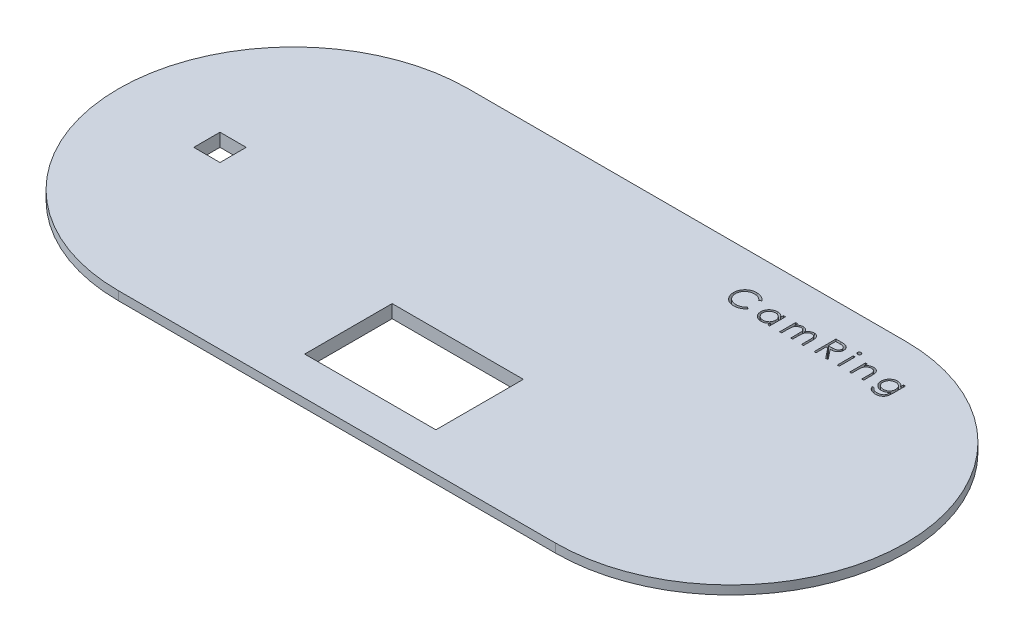
from build123d import *

# Parameters (mm, degrees)
SALIENTE_EXTRUIR1_DEPTH = 2
SALIENTE_EXTRUIR3_DEPTH = 3
CROQUIS3_W              = 30
CROQUIS3_H              = 20
CORTAR_EXTRUIR1_DEPTH   = 3
CROQUIS5_W              = 6
CROQUIS5_H              = 6
CORTAR_EXTRUIR2_DEPTH   = 3
CROQUIS6_W              = 0.448717948
CROQUIS6_H              = 3.653846154
CORTAR_EXTRUIR3_DEPTH   = 3


with BuildPart() as part:
    # Croquis1 → Saliente-Extruir1 (new body)
    with BuildSketch(Plane(origin=(0, 0, 0), x_dir=(1, 0, 0), z_dir=(0, 1, 0))):
        with BuildLine():
            Line((-48.84341637, 40), (51.15658363, 40))
            ThreePointArc((51.15658363, 40), (91.15658363, 0), (51.15658363, -40))
            Line((51.15658363, -40), (-48.84341637, -40))
            ThreePointArc((-48.84341637, -40), (-88.84341637, 0), (-48.84341637, 40))
        make_face()
    extrude(amount=SALIENTE_EXTRUIR1_DEPTH)

    # Croquis2 → Saliente-Extruir3 (add)
    with BuildSketch(Plane(origin=(0, 2, 0), x_dir=(1, 0, 0), z_dir=(0, 1, 0))):
        with BuildLine():
            Line((-49.84341637, 38), (50.15658363, 38))
            ThreePointArc((50.15658363, 38), (88.15658363, 0), (50.15658363, -38))
            Line((50.15658363, -38), (-49.84341637, -38))
            ThreePointArc((-49.84341637, -38), (-87.84341637, 0), (-49.84341637, 38))
        make_face()
    extrude(amount=-SALIENTE_EXTRUIR3_DEPTH)

    # Croquis3 → Cortar-Extruir1 (cut)
    with BuildSketch(Plane(origin=(0, 2, 0), x_dir=(1, 0, 0), z_dir=(0, 1, 0))):
        with Locations((0, -21.252534321)):
            Rectangle(CROQUIS3_W, CROQUIS3_H)
    extrude(amount=-CORTAR_EXTRUIR1_DEPTH, mode=Mode.SUBTRACT)

    # Croquis5 → Cortar-Extruir2 (cut)
    with BuildSketch(Plane(origin=(0, 2, 0), x_dir=(1, 0, 0), z_dir=(0, 1, 0))):
        with Locations((-65.624151303, 0)):
            Rectangle(CROQUIS5_W, CROQUIS5_H)
    extrude(amount=-CORTAR_EXTRUIR2_DEPTH, mode=Mode.SUBTRACT)

    # Croquis6 → Cortar-Extruir3 (cut)
    # profile 1 of 8: a face of its own
    with BuildSketch(Plane(origin=(0, 2, 0), x_dir=(1, 0, 0), z_dir=(0, 1, 0))):
        with BuildLine():
            Line((26.715211632, 31.55532032), (26.322583427, 31.25483955))
            add(Edge.make_bspline(
                [(26.322583427, 31.25483955), (26.294575015, 31.288219507), (26.238935805, 31.354529387), (26.149422658, 31.447643022), (26.056134597, 31.53487911), (25.959107281, 31.616653223), (25.856594253, 31.690105746), (25.751078827, 31.759064464), (25.640795905, 31.820875518), (25.488293427, 31.895822641), (25.288796501, 31.974031434), (25.037661016, 32.039607479), (24.775502304, 32.081352016), (24.59664859, 32.085873218), (24.505676375, 32.088172884)],
                knots=[0, 0, 0, 0, 0.757959112, 1.505699292, 2.245454638, 2.979532153, 3.711538275, 4.438200793, 5.171680507, 5.909471876, 7.393775596, 8.890124382, 10.418191784, 12, 12, 12, 12], degree=3))
            add(Edge.make_bspline(
                [(24.505676375, 32.088172884), (24.455557376, 32.087595794), (24.35578453, 32.086446972), (24.207715282, 32.071291079), (24.062410923, 32.04998935), (23.919965971, 32.018381745), (23.780561745, 31.978420861), (23.643286885, 31.93067027), (23.510128885, 31.871591927), (23.379245688, 31.806294413), (23.253846815, 31.73254092), (23.135196747, 31.652093275), (23.023728221, 31.565851708), (22.919353061, 31.473492985), (22.821964563, 31.375433041), (22.732268405, 31.270626839), (22.650574962, 31.159409448), (22.575264926, 31.043247438), (22.507818164, 30.922479164), (22.451346908, 30.796657635), (22.40133959, 30.667937487), (22.361769243, 30.534864401), (22.330448505, 30.398374735), (22.308837558, 30.258102181), (22.293854027, 30.114339781), (22.292710917, 30.016897906), (22.292134709, 29.967780255)],
                knots=[0, 0, 0, 0, 1.054917814, 2.100044995, 3.131103042, 4.146048494, 5.169673617, 6.183595914, 7.203665975, 8.234915748, 9.262203917, 10.264457458, 11.251630812, 12.227803204, 13.197192746, 14.159520551, 15.12972552, 16.100847026, 17.073214652, 18.039054194, 19.002613845, 19.979014051, 20.95965708, 21.949030935, 22.966165397, 24, 24, 24, 24], degree=3))
            add(Edge.make_bspline(
                [(22.292134709, 29.967780255), (22.293937307, 29.89387837), (22.29747647, 29.74878182), (22.328974091, 29.536252376), (22.376838507, 29.332651414), (22.448575045, 29.139251639), (22.537030832, 28.95366827), (22.648803134, 28.779041337), (22.77825533, 28.612731959), (22.927218786, 28.458670605), (23.090655666, 28.317936712), (23.266009826, 28.19400731), (23.452844523, 28.090700335), (23.649096852, 28.004734697), (23.856277014, 27.938653657), (24.074012446, 27.892133481), (24.301829582, 27.861787509), (24.457500154, 27.85888224), (24.536726055, 27.857403653)],
                knots=[0, 0, 0, 0, 1.029171465, 2.020641659, 2.987623507, 3.938342917, 4.889210282, 5.84687017, 6.821220943, 7.821438502, 8.827599549, 9.822697543, 10.807740252, 11.797342354, 12.80366471, 13.83203677, 14.896651826, 16, 16, 16, 16], degree=3))
            add(Edge.make_bspline(
                [(24.536726055, 27.857403653), (24.62401561, 27.859816195), (24.795822338, 27.864564656), (25.047776661, 27.904792155), (25.288970612, 27.970017752), (25.519417164, 28.061300498), (25.738466659, 28.179965195), (25.946461888, 28.323819306), (26.143578417, 28.494231209), (26.26210882, 28.624349964), (26.322583427, 28.690736986)],
                knots=[0, 0, 0, 0, 1.028121516, 2.023589091, 2.998037872, 3.967518031, 4.937445131, 5.927275754, 6.942489185, 8, 8, 8, 8], degree=3))
            Line((26.322583427, 28.690736986), (26.715211632, 28.393261025))
            add(Edge.make_bspline(
                [(26.715211632, 28.393261025), (26.683614332, 28.352491808), (26.620571081, 28.271148656), (26.5184882, 28.156474785), (26.410949204, 28.048611877), (26.297155332, 27.948429561), (26.17841563, 27.853923181), (26.052598041, 27.767777708), (25.921356566, 27.688790731), (25.785135882, 27.616466553), (25.644080721, 27.552299057), (25.498360099, 27.497365103), (25.348602134, 27.450043832), (25.19479998, 27.411112494), (25.036634613, 27.380725231), (24.874676792, 27.36041141), (24.708576971, 27.34649439), (24.596517798, 27.345225938), (24.539730862, 27.34458314)],
                knots=[0, 0, 0, 0, 0.986787822, 1.968848986, 2.935600012, 3.899624008, 4.868462664, 5.837806735, 6.815139263, 7.798259679, 8.787526145, 9.778297419, 10.776456485, 11.791383307, 12.812564526, 13.85620153, 14.913611965, 16, 16, 16, 16], degree=3))
            add(Edge.make_bspline(
                [(24.539730862, 27.34458314), (24.485954195, 27.344957415), (24.379617495, 27.345697498), (24.222619279, 27.357686308), (24.06977702, 27.374043075), (23.921527555, 27.398671834), (23.777061876, 27.427735177), (23.637689613, 27.466694115), (23.502039312, 27.510335782), (23.370655968, 27.56162862), (23.243427826, 27.619508881), (23.120765238, 27.684925393), (23.00272462, 27.757328057), (22.888145448, 27.835120929), (22.778720328, 27.920802789), (22.673501006, 28.013183695), (22.571897469, 28.111952282), (22.50903649, 28.183173501), (22.477431183, 28.218982178)],
                knots=[0, 0, 0, 0, 1.114604814, 2.203992996, 3.262667896, 4.300477797, 5.318619304, 6.316056647, 7.298880507, 8.271930387, 9.238335007, 10.195173496, 11.151986948, 12.108099108, 13.064862484, 14.031167946, 15.010108607, 16, 16, 16, 16], degree=3))
            add(Edge.make_bspline(
                [(22.477431183, 28.218982178), (22.426808835, 28.281183877), (22.326175297, 28.40483632), (22.19742432, 28.605244865), (22.087213527, 28.814485163), (21.998105069, 29.03365649), (21.928444022, 29.262267043), (21.880185171, 29.500432064), (21.848825736, 29.747929124), (21.84523961, 29.916267394), (21.84341676, 30.001834743)],
                knots=[0, 0, 0, 0, 0.994628077, 1.977248131, 2.950237994, 3.925870899, 4.908910175, 5.911660606, 6.938484602, 8, 8, 8, 8], degree=3))
            add(Edge.make_bspline(
                [(21.84341676, 30.001834743), (21.845638465, 30.091771105), (21.850009531, 30.268715283), (21.887146382, 30.528392359), (21.946887519, 30.777180072), (22.031740217, 31.014613992), (22.13931929, 31.241942964), (22.272214453, 31.4574304), (22.428881799, 31.662454399), (22.60809261, 31.853904044), (22.804617375, 32.028960262), (23.015072823, 32.182969124), (23.239047033, 32.311137004), (23.474072536, 32.418274379), (23.721909223, 32.500623612), (23.982028322, 32.558271022), (24.253941058, 32.594152617), (24.439458809, 32.598688628), (24.533721247, 32.600993396)],
                knots=[0, 0, 0, 0, 1.032925535, 2.032216505, 3.007276963, 3.968222605, 4.92396291, 5.891752235, 6.871517503, 7.883894988, 8.900124299, 9.891468569, 10.874487609, 11.85992873, 12.854644235, 13.869047385, 14.917252991, 16, 16, 16, 16], degree=3))
            add(Edge.make_bspline(
                [(24.533721247, 32.600993396), (24.591170493, 32.600304628), (24.704885489, 32.598941279), (24.873103564, 32.58564679), (25.036878317, 32.563484496), (25.196322577, 32.533318682), (25.352212028, 32.495879651), (25.50335523, 32.447107796), (25.650639068, 32.391341323), (25.793134651, 32.327114943), (25.930158294, 32.255019598), (26.061667321, 32.175854422), (26.186617119, 32.089717557), (26.305886902, 31.997341592), (26.417481489, 31.896772221), (26.524569316, 31.790775656), (26.623513713, 31.676298764), (26.684589706, 31.595720287), (26.715211632, 31.55532032)],
                knots=[0, 0, 0, 0, 1.096760587, 2.17092713, 3.219439832, 4.250915756, 5.268269357, 6.278326846, 7.281116186, 8.274029601, 9.260640565, 10.235837813, 11.203064059, 12.156899882, 13.114053108, 14.069676657, 15.032185724, 16, 16, 16, 16], degree=3))
        make_face()
    # profile 2 of 8: a face of its own
    with BuildSketch(Plane(origin=(0, 2, 0), x_dir=(1, 0, 0), z_dir=(0, 1, 0))):
        with BuildLine():
            Line((32.599827016, 31.126634422), (32.599827016, 27.472788268))
            Line((32.599827016, 27.472788268), (32.151109068, 27.472788268))
            Line((32.151109068, 27.472788268), (32.151109068, 28.104799486))
            add(Edge.make_bspline(
                [(32.151109068, 28.104799486), (32.100510795, 28.047600066), (32.001767631, 27.935974679), (31.836851748, 27.790143004), (31.662040065, 27.669602545), (31.478181035, 27.572245522), (31.285440687, 27.499114013), (31.084246277, 27.447133786), (30.874515733, 27.413714021), (30.731298083, 27.410376847), (30.658721247, 27.408685704)],
                knots=[0, 0, 0, 0, 1.074387032, 2.096679803, 3.090159297, 4.057316773, 5.018401886, 5.985159533, 6.978961417, 8, 8, 8, 8], degree=3))
            add(Edge.make_bspline(
                [(30.658721247, 27.408685704), (30.594195599, 27.410437665), (30.466948163, 27.413892608), (30.279763767, 27.440695899), (30.099631982, 27.483739644), (29.926382593, 27.543598058), (29.761136671, 27.622999231), (29.60247939, 27.718058157), (29.451232687, 27.831259343), (29.309701917, 27.960670812), (29.179370488, 28.101235079), (29.064997241, 28.251157289), (28.969635699, 28.409789152), (28.889892726, 28.575122229), (28.828469377, 28.748429257), (28.785649899, 28.929110925), (28.758877833, 29.116953602), (28.755424318, 29.244867206), (28.75367317, 29.309727371)],
                knots=[0, 0, 0, 0, 1.033919861, 2.038935746, 3.024066025, 3.998881131, 4.97069526, 5.957263378, 6.95902576, 7.993208707, 9.027059324, 10.027763471, 11.009749337, 11.988697705, 12.965288445, 13.950418724, 14.960734635, 16, 16, 16, 16], degree=3))
            add(Edge.make_bspline(
                [(28.75367317, 29.309727371), (28.755463129, 29.373246947), (28.759001782, 29.498821724), (28.785363525, 29.683505578), (28.829693537, 29.861388807), (28.891904748, 30.031898726), (28.971678969, 30.195241655), (29.068719094, 30.351533119), (29.183032129, 30.501203687), (29.314821282, 30.640734011), (29.457585239, 30.769620603), (29.610311998, 30.881633525), (29.769202399, 30.978371881), (29.936720986, 31.055019704), (30.110388278, 31.11703271), (30.291750344, 31.15993695), (30.480052599, 31.185218838), (30.607896159, 31.18887993), (30.672743683, 31.190736986)],
                knots=[0, 0, 0, 0, 1.020392517, 2.01726096, 2.990465484, 3.961182959, 4.928053699, 5.906110375, 6.912531644, 7.948652711, 8.985773172, 9.998621852, 10.987621588, 11.969261332, 12.953316658, 13.946091881, 14.958173133, 16, 16, 16, 16], degree=3))
            add(Edge.make_bspline(
                [(30.672743683, 31.190736986), (30.74731491, 31.188683055), (30.893545567, 31.184655394), (31.107442723, 31.151137212), (31.309791978, 31.094510831), (31.502155338, 31.017485833), (31.683842032, 30.915130506), (31.85313201, 30.786016276), (32.011796986, 30.630957438), (32.103768831, 30.511856803), (32.151109068, 30.450552691)],
                knots=[0, 0, 0, 0, 1.038897134, 2.037228247, 3.008116434, 3.962042015, 4.918381754, 5.904844433, 6.921570401, 8, 8, 8, 8], degree=3))
            Line((32.151109068, 30.450552691), (32.151109068, 31.126634422))
            Line((32.151109068, 31.126634422), (32.599827016, 31.126634422))
        make_face()
        with BuildLine():
            add(Edge.make_bspline(
                [(30.678753298, 30.742019037), (30.613161387, 30.739685269), (30.483693387, 30.735078782), (30.293630527, 30.699116646), (30.111754221, 30.639281511), (29.938974115, 30.557450224), (29.77801952, 30.454552029), (29.634171419, 30.33009291), (29.506253274, 30.187468604), (29.398670039, 30.027322732), (29.310969329, 29.855639745), (29.249302141, 29.676176262), (29.208631788, 29.492169151), (29.204476758, 29.367365314), (29.202391119, 29.304719358)],
                knots=[0, 0, 0, 0, 1.031046209, 2.035121221, 3.029706178, 4.034933723, 5.034054252, 6.02443088, 7.017295772, 8.038157696, 9.050218397, 10.03989886, 11.016116709, 12, 12, 12, 12], degree=3))
            add(Edge.make_bspline(
                [(29.202391119, 29.304719358), (29.205055252, 29.242447776), (29.210373076, 29.118148696), (29.248588354, 28.93389073), (29.312702459, 28.754384955), (29.40019112, 28.581154965), (29.509743441, 28.420320535), (29.63672723, 28.274977503), (29.782370489, 28.149992377), (29.943695499, 28.045367272), (30.1159926, 27.960849385), (30.297183931, 27.902041329), (30.483863414, 27.864073071), (30.610795319, 27.859638104), (30.674746888, 27.857403653)],
                knots=[0, 0, 0, 0, 0.979072187, 1.954306742, 2.945804271, 3.96968567, 4.997920485, 5.998718438, 6.996577872, 8.005894225, 9.015743152, 10.005417472, 10.995077863, 12, 12, 12, 12], degree=3))
            add(Edge.make_bspline(
                [(30.674746888, 27.857403653), (30.739670463, 27.85977503), (30.868797016, 27.864491464), (31.059423741, 27.900607557), (31.244416545, 27.960277269), (31.421255443, 28.042990307), (31.585992773, 28.145500815), (31.733846884, 28.265510945), (31.858869696, 28.405086923), (31.964859138, 28.558481856), (32.047966876, 28.726641851), (32.108504104, 28.905690695), (32.144295398, 29.095634621), (32.14880644, 29.22544023), (32.151109068, 29.291698525)],
                knots=[0, 0, 0, 0, 1.01762866, 2.023962475, 3.030623092, 4.058876274, 5.077231937, 6.066672613, 7.034107872, 8.005628644, 8.981990164, 9.965428785, 10.961468474, 12, 12, 12, 12], degree=3))
            add(Edge.make_bspline(
                [(32.151109068, 29.291698525), (32.14973813, 29.34218114), (32.147039691, 29.441546902), (32.126424591, 29.587443355), (32.093631839, 29.727062964), (32.047423025, 29.86055252), (31.98672119, 29.98717397), (31.913510096, 30.107836485), (31.826502311, 30.221912501), (31.727098459, 30.327831174), (31.618291027, 30.424440406), (31.503155969, 30.510675035), (31.380329188, 30.581516139), (31.251876278, 30.640146527), (31.117574371, 30.686802456), (30.976330629, 30.717927732), (30.829646362, 30.73929962), (30.729580568, 30.741103021), (30.678753298, 30.742019037)],
                knots=[0, 0, 0, 0, 1.050140795, 2.067009409, 3.05949893, 4.030605086, 5.00011959, 5.97591094, 6.962425594, 7.979863591, 8.993523472, 9.986985069, 10.967611495, 11.937549037, 12.921786183, 13.919465291, 14.943216303, 16, 16, 16, 16], degree=3))
        make_face(mode=Mode.SUBTRACT)
    # profile 3 of 8: a face of its own
    with BuildSketch(Plane(origin=(0, 2, 0), x_dir=(1, 0, 0), z_dir=(0, 1, 0))):
        with BuildLine():
            Line((34.894698811, 31.126634422), (35.34341676, 31.126634422))
            Line((35.34341676, 31.126634422), (35.34341676, 30.491618396))
            add(Edge.make_bspline(
                [(35.34341676, 30.491618396), (35.383822403, 30.547172113), (35.461243488, 30.65361836), (35.58819442, 30.793890195), (35.715017438, 30.912930416), (35.80635084, 30.975420233), (35.850227657, 31.005440512)],
                knots=[0, 0, 0, 0, 1.134379233, 2.173579362, 3.122582517, 4, 4, 4, 4], degree=3))
            add(Edge.make_bspline(
                [(35.850227657, 31.005440512), (35.910034318, 31.034019605), (36.028602746, 31.090678481), (36.216344496, 31.148154994), (36.408451166, 31.183476567), (36.538177186, 31.188307101), (36.603432786, 31.190736986)],
                knots=[0, 0, 0, 0, 1.014936303, 2.012140481, 3.000054389, 4, 4, 4, 4], degree=3))
            add(Edge.make_bspline(
                [(36.603432786, 31.190736986), (36.647565638, 31.189243714), (36.734902179, 31.186288608), (36.864308022, 31.167059986), (36.989820325, 31.133822596), (37.11069751, 31.087526419), (37.224584194, 31.031459723), (37.328997334, 30.965674426), (37.422746203, 30.891821461), (37.505783419, 30.806565843), (37.580453455, 30.707513559), (37.649137522, 30.591993204), (37.712602111, 30.457410831), (37.747775409, 30.359744344), (37.766293362, 30.308325127)],
                knots=[0, 0, 0, 0, 1.009824226, 1.998387844, 2.986035974, 3.974953746, 4.955485308, 5.885931332, 6.793869504, 7.679848016, 8.601185859, 9.625726857, 10.749998409, 12, 12, 12, 12], degree=3))
            add(Edge.make_bspline(
                [(37.766293362, 30.308325127), (37.785880864, 30.343645726), (37.824426317, 30.413151705), (37.889148656, 30.511520651), (37.956959794, 30.603530353), (38.028437641, 30.689253817), (38.103329908, 30.768267717), (38.181989051, 30.840833291), (38.263967311, 30.907262168), (38.377956225, 30.984866681), (38.52625995, 31.067296941), (38.713242971, 31.138766146), (38.907743216, 31.182932044), (39.039768499, 31.188118148), (39.106437593, 31.190736986)],
                knots=[0, 0, 0, 0, 0.86119277, 1.694706429, 2.50939023, 3.298075842, 4.073795165, 4.829715201, 5.57930267, 6.321991688, 7.768977793, 9.186738141, 10.579381044, 12, 12, 12, 12], degree=3))
            add(Edge.make_bspline(
                [(39.106437593, 31.190736986), (39.167696826, 31.188426671), (39.287587092, 31.183905159), (39.462126043, 31.148400197), (39.624900051, 31.08743213), (39.775581588, 31.00424122), (39.911524178, 30.89969953), (40.029690334, 30.775315476), (40.129362282, 30.631968872), (40.194474624, 30.497123174), (40.238639288, 30.378072698), (40.265869622, 30.276635139), (40.28992633, 30.164990064), (40.309899537, 30.043003976), (40.324497469, 29.910245964), (40.335312777, 29.766933284), (40.342632882, 29.612954553), (40.343150128, 29.506718124), (40.34341676, 29.451954935)],
                knots=[0, 0, 0, 0, 1.209669288, 2.367440248, 3.500751976, 4.631527125, 5.755587489, 6.87532382, 8.007944318, 9.190864318, 9.82315674, 10.514484317, 11.263564316, 12.079023757, 12.955305781, 13.901327259, 14.918167583, 16, 16, 16, 16], degree=3))
            Line((40.34341676, 29.451954935), (40.34341676, 27.472788268))
            Line((40.34341676, 27.472788268), (39.894698811, 27.472788268))
            Line((39.894698811, 27.472788268), (39.894698811, 29.45395814))
            add(Edge.make_bspline(
                [(39.894698811, 29.45395814), (39.89458755, 29.500701817), (39.894373722, 29.590536055), (39.890525677, 29.719468129), (39.883275229, 29.836994353), (39.874797173, 29.942954479), (39.863020303, 30.037595606), (39.847811829, 30.120727632), (39.831700857, 30.193004505), (39.804935156, 30.273127431), (39.762152454, 30.361513446), (39.696984625, 30.45683284), (39.614884473, 30.539805411), (39.520084249, 30.611831578), (39.4121579, 30.670393923), (39.293208295, 30.712216794), (39.163973936, 30.73810662), (39.07451281, 30.740686642), (39.028312593, 30.742019037)],
                knots=[0, 0, 0, 0, 1.253487763, 2.409012846, 3.458416907, 4.410876679, 5.259312806, 6.014470957, 6.676830364, 7.243083969, 8.276244668, 9.299465089, 10.325150304, 11.392391894, 12.482080715, 13.603491619, 14.762376348, 16, 16, 16, 16], degree=3))
            add(Edge.make_bspline(
                [(39.028312593, 30.742019037), (38.97164123, 30.739995955), (38.859637071, 30.735997576), (38.696143519, 30.695177758), (38.539042067, 30.633634543), (38.393020449, 30.544445318), (38.258695033, 30.437576227), (38.143124208, 30.310505376), (38.047649657, 30.166748337), (37.98300112, 30.03368162), (37.942159261, 29.914153843), (37.915192239, 29.809729026), (37.894215965, 29.691041072), (37.87454378, 29.558887513), (37.861704169, 29.412358684), (37.850035066, 29.252132397), (37.84457669, 29.077726741), (37.843813178, 28.956831471), (37.84341676, 28.894062307)],
                knots=[0, 0, 0, 0, 1.090531906, 2.155305635, 3.229839962, 4.33261226, 5.44038871, 6.529323825, 7.629011124, 8.757537029, 9.370236727, 10.061839251, 10.834451254, 11.692844982, 12.636905849, 13.66920014, 14.789842145, 16, 16, 16, 16], degree=3))
            Line((37.84341676, 28.894062307), (37.84341676, 27.472788268))
            Line((37.84341676, 27.472788268), (37.394698811, 27.472788268))
            Line((37.394698811, 27.472788268), (37.394698811, 29.330761025))
            add(Edge.make_bspline(
                [(37.394698811, 29.330761025), (37.394585338, 29.383180051), (37.394367028, 29.48402899), (37.390543718, 29.628648526), (37.383277115, 29.760192927), (37.374876332, 29.878509303), (37.362790362, 29.98338263), (37.349062131, 30.075375142), (37.33284983, 30.154256215), (37.306007138, 30.240775336), (37.264986469, 30.33609094), (37.199003237, 30.43772097), (37.116706694, 30.526675395), (37.020176871, 30.602616465), (36.911597325, 30.665390009), (36.791621039, 30.710618226), (36.661328306, 30.73693864), (36.571503012, 30.740293635), (36.525307786, 30.742019037)],
                knots=[0, 0, 0, 0, 1.320475261, 2.540461679, 3.643808994, 4.639130445, 5.527981419, 6.302341397, 6.981980563, 7.553956391, 8.582137848, 9.585246428, 10.591171744, 11.620968678, 12.668337649, 13.738356861, 14.836885341, 16, 16, 16, 16], degree=3))
            add(Edge.make_bspline(
                [(36.525307786, 30.742019037), (36.470998912, 30.739832666), (36.362763256, 30.735475305), (36.203760442, 30.696254914), (36.050209465, 30.634820522), (35.904559896, 30.549592209), (35.770739684, 30.444022096), (35.653585016, 30.31985796), (35.555095694, 30.178645055), (35.48976453, 30.04698146), (35.447623853, 29.93044821), (35.419630517, 29.831375427), (35.395573909, 29.721375073), (35.377696735, 29.600107771), (35.360438999, 29.468363351), (35.352109986, 29.325485508), (35.344007754, 29.171596812), (35.34361859, 29.065350318), (35.34341676, 29.010248204)],
                knots=[0, 0, 0, 0, 1.098833095, 2.189935336, 3.297829714, 4.440610912, 5.596351641, 6.740013378, 7.886572111, 9.072425424, 9.705826452, 10.395263256, 11.156850408, 11.985370555, 12.878090359, 13.847760091, 14.883794034, 16, 16, 16, 16], degree=3))
            Line((35.34341676, 29.010248204), (35.34341676, 27.472788268))
            Line((35.34341676, 27.472788268), (34.894698811, 27.472788268))
            Line((34.894698811, 27.472788268), (34.894698811, 31.126634422))
        make_face()
    # profile 4 of 8: a face of its own
    with BuildSketch(Plane(origin=(0, 2, 0), x_dir=(1, 0, 0), z_dir=(0, 1, 0))):
        with BuildLine():
            Line((42.766493683, 32.472788268), (43.767094645, 32.472788268))
            add(Edge.make_bspline(
                [(43.767094645, 32.472788268), (43.833867685, 32.472566003), (43.96207932, 32.472139228), (44.145755421, 32.469759566), (44.312651273, 32.462939058), (44.462679615, 32.457069653), (44.595837694, 32.44636688), (44.712533824, 32.436137384), (44.812230534, 32.42274644), (44.87258175, 32.410310122), (44.899907145, 32.404679294)],
                knots=[0, 0, 0, 0, 1.410062039, 2.707475311, 3.878576406, 4.937260626, 5.877586885, 6.699081471, 7.410979367, 8, 8, 8, 8], degree=3))
            add(Edge.make_bspline(
                [(44.899907145, 32.404679294), (44.936488036, 32.395641058), (45.00886945, 32.377757395), (45.11308383, 32.339957966), (45.212390007, 32.296215645), (45.30637547, 32.244838901), (45.394569458, 32.185446359), (45.47788133, 32.119063327), (45.556689135, 32.046053033), (45.627805749, 31.964574688), (45.694861538, 31.87909396), (45.751416718, 31.786660021), (45.800168832, 31.690000696), (45.838983857, 31.588132957), (45.870238104, 31.482044711), (45.892275589, 31.370775002), (45.905491571, 31.254830752), (45.906837079, 31.175748025), (45.907519324, 31.135648845)],
                knots=[0, 0, 0, 0, 1.027469482, 2.033020251, 3.019912614, 3.986113645, 4.951240523, 5.91722682, 6.890402269, 7.87763091, 8.8651537, 9.85103654, 10.82876324, 11.815024772, 12.821070561, 13.842952187, 14.906261191, 16, 16, 16, 16], degree=3))
            add(Edge.make_bspline(
                [(45.907519324, 31.135648845), (45.905420755, 31.069027267), (45.901325904, 30.939031313), (45.863147185, 30.750372911), (45.800609299, 30.574388176), (45.714433172, 30.411298693), (45.604691064, 30.264283485), (45.472798505, 30.135154264), (45.318681917, 30.027097246), (45.175211466, 29.952164667), (45.048476895, 29.904174798), (44.944143591, 29.870408571), (44.830333623, 29.844320049), (44.708137431, 29.820948432), (44.577046495, 29.803303155), (44.43737501, 29.790379448), (44.289023364, 29.782302236), (44.187110408, 29.781099372), (44.134682786, 29.780480576)],
                knots=[0, 0, 0, 0, 1.260483769, 2.459530307, 3.627416485, 4.787058657, 5.939039949, 7.08810263, 8.267026773, 9.491475466, 10.141966685, 10.831826277, 11.566392101, 12.351337768, 13.187381173, 14.07005841, 15.007169909, 16, 16, 16, 16], degree=3))
            Line((44.134682786, 29.780480576), (45.971621888, 27.472788268))
            Line((45.971621888, 27.472788268), (45.416734068, 27.472788268))
            Line((45.416734068, 27.472788268), (43.579794965, 29.780480576))
            Line((43.579794965, 29.780480576), (43.215211632, 29.780480576))
            Line((43.215211632, 29.780480576), (43.215211632, 27.472788268))
            Line((43.215211632, 27.472788268), (42.766493683, 27.472788268))
            Line((42.766493683, 27.472788268), (42.766493683, 32.472788268))
        make_face()
        with BuildLine():
            Line((43.215211632, 31.959967755), (43.215211632, 30.293301089))
            Line((43.215211632, 30.293301089), (44.130676375, 30.286289871))
            add(Edge.make_bspline(
                [(44.130676375, 30.286289871), (44.173419288, 30.286270961), (44.256267227, 30.286234309), (44.376125319, 30.291939704), (44.487725479, 30.298430159), (44.590640839, 30.308357795), (44.684917375, 30.321152183), (44.770507966, 30.337156446), (44.847552326, 30.35580225), (44.93740738, 30.384661716), (45.037745282, 30.430384599), (45.146790225, 30.49690674), (45.239650708, 30.58057691), (45.318104797, 30.676253276), (45.381146841, 30.781447917), (45.425592633, 30.894899873), (45.453796122, 31.013745013), (45.457122616, 31.095428024), (45.458801375, 31.136650448)],
                knots=[0, 0, 0, 0, 1.146690395, 2.22261258, 3.21895312, 4.145990853, 4.996080663, 5.770904154, 6.481378293, 7.121626537, 8.300444488, 9.431385265, 10.535395872, 11.636531494, 12.74115979, 13.810798291, 14.895190096, 16, 16, 16, 16], degree=3))
            add(Edge.make_bspline(
                [(45.458801375, 31.136650448), (45.457084059, 31.176859839), (45.453680966, 31.25654018), (45.425897011, 31.37319148), (45.378912181, 31.483287123), (45.315594698, 31.586379245), (45.238453048, 31.679958867), (45.14799903, 31.760026229), (45.046705894, 31.826096893), (44.952032753, 31.868317436), (44.86741245, 31.894202941), (44.793941507, 31.912418889), (44.71092511, 31.927053845), (44.617960169, 31.938779646), (44.515443554, 31.948858138), (44.402856909, 31.955646393), (44.280947223, 31.959666199), (44.196451607, 31.959864897), (44.152711632, 31.959967755)],
                knots=[0, 0, 0, 0, 1.101028733, 2.181837193, 3.264309656, 4.369019818, 5.486613113, 6.575447106, 7.666700264, 8.788928104, 9.402425223, 10.0903467, 10.862060571, 11.710948788, 12.657782767, 13.684531032, 14.801375019, 16, 16, 16, 16], degree=3))
            Line((44.152711632, 31.959967755), (43.215211632, 31.959967755))
        make_face(mode=Mode.SUBTRACT)
    # profile 5 of 8: a face of its own
    with BuildSketch(Plane(origin=(0, 2, 0), x_dir=(1, 0, 0), z_dir=(0, 1, 0))):
        with BuildLine():
            add(Edge.make_bspline(
                [(48.29654176, 32.665095961), (48.324386497, 32.663804314), (48.378911839, 32.661275023), (48.457759365, 32.63961577), (48.529555096, 32.602901933), (48.593237572, 32.553645246), (48.647883124, 32.49571747), (48.686141282, 32.428201801), (48.710730419, 32.355260889), (48.713699784, 32.30438219), (48.715211632, 32.278477371)],
                knots=[0, 0, 0, 0, 1.055194115, 2.066272739, 3.074728998, 4.095836921, 5.109056067, 6.073838105, 7.019297344, 8, 8, 8, 8], degree=3))
            add(Edge.make_bspline(
                [(48.715211632, 32.278477371), (48.713665689, 32.253245009), (48.710609544, 32.203363616), (48.686160275, 32.131687228), (48.647557078, 32.06510968), (48.593272612, 32.007294379), (48.529545811, 31.958064922), (48.457761831, 31.921343867), (48.378911191, 31.899686528), (48.324386277, 31.897156972), (48.29654176, 31.895865191)],
                knots=[0, 0, 0, 0, 0.96129708, 1.900370562, 2.859976407, 3.87933698, 4.906634145, 5.921202961, 6.938410037, 8, 8, 8, 8], degree=3))
            add(Edge.make_bspline(
                [(48.29654176, 31.895865191), (48.269015653, 31.897107649), (48.215439681, 31.89952593), (48.137772763, 31.921768812), (48.066589207, 31.958077488), (48.002782532, 32.006972038), (47.949596542, 32.065464749), (47.910884648, 32.131646597), (47.886491845, 32.203373961), (47.88342809, 32.253248484), (47.881878298, 32.278477371)],
                knots=[0, 0, 0, 0, 1.054934014, 2.053291228, 3.073705704, 4.106921865, 5.123545215, 6.088680038, 7.033164197, 8, 8, 8, 8], degree=3))
            add(Edge.make_bspline(
                [(47.881878298, 32.278477371), (47.883394136, 32.304378585), (47.886371338, 32.355250203), (47.910902932, 32.428243107), (47.949274086, 32.495359538), (48.002817749, 32.553967394), (48.066579835, 32.602889444), (48.137775185, 32.639190846), (48.215439041, 32.661435617), (48.269015435, 32.663853637), (48.29654176, 32.665095961)],
                knots=[0, 0, 0, 0, 0.98631895, 1.937192651, 2.907499808, 3.917963147, 4.944918757, 5.95915025, 6.951458133, 8, 8, 8, 8], degree=3))
        make_face()
    # profile 6 of 8: a face of its own
    with BuildSketch(Plane(origin=(0, 2, 0), x_dir=(1, 0, 0), z_dir=(0, 1, 0))):
        with Locations((48.298544965, 29.299711345)):
            Rectangle(CROQUIS6_W, CROQUIS6_H)
    # profile 7 of 8: a face of its own
    with BuildSketch(Plane(origin=(0, 2, 0), x_dir=(1, 0, 0), z_dir=(0, 1, 0))):
        with BuildLine():
            Line((50.881878298, 31.126634422), (51.330596247, 31.126634422))
            Line((51.330596247, 31.126634422), (51.330596247, 30.467579935))
            add(Edge.make_bspline(
                [(51.330596247, 30.467579935), (51.378507154, 30.527355253), (51.471479942, 30.643351344), (51.626314703, 30.795809308), (51.789948847, 30.921445343), (51.96138028, 31.02159362), (52.140841723, 31.097088801), (52.327239252, 31.151611559), (52.521688832, 31.184304172), (52.653923742, 31.188575929), (52.720820606, 31.190736986)],
                knots=[0, 0, 0, 0, 1.12780773, 2.188550248, 3.19190651, 4.159438251, 5.104880172, 6.052711206, 7.014878035, 8, 8, 8, 8], degree=3))
            add(Edge.make_bspline(
                [(52.720820606, 31.190736986), (52.788435798, 31.18824385), (52.920775037, 31.183364181), (53.113457982, 31.144768908), (53.293419973, 31.078847115), (53.460019339, 30.988544157), (53.610201072, 30.876249195), (53.742093717, 30.745423792), (53.85118407, 30.594943673), (53.92432316, 30.455339165), (53.972502657, 30.33149803), (54.002834568, 30.225431244), (54.028593113, 30.107262457), (54.050924181, 29.977348758), (54.066034341, 29.834779915), (54.0779519, 29.680140355), (54.086492892, 29.513480168), (54.086831759, 29.398213558), (54.087006503, 29.338773845)],
                knots=[0, 0, 0, 0, 1.235846778, 2.418850247, 3.575807741, 4.728682307, 5.871620074, 6.994088408, 8.11269785, 9.256955736, 9.865816715, 10.540099792, 11.271859618, 12.076849838, 12.949306005, 13.892391288, 14.913166135, 16, 16, 16, 16], degree=3))
            Line((54.087006503, 29.338773845), (54.087006503, 27.472788268))
            Line((54.087006503, 27.472788268), (53.638288555, 27.472788268))
            Line((53.638288555, 27.472788268), (53.638288555, 29.191538268))
            add(Edge.make_bspline(
                [(53.638288555, 29.191538268), (53.638012543, 29.241284618), (53.63748458, 29.336440919), (53.635819371, 29.472682381), (53.631805361, 29.596234636), (53.626164914, 29.706802304), (53.617909156, 29.804279213), (53.609305397, 29.888863894), (53.598784002, 29.960448955), (53.589408412, 30.003541929), (53.585203619, 30.022868396)],
                knots=[0, 0, 0, 0, 1.430800155, 2.736877192, 3.918605307, 4.986035426, 5.920637409, 6.731861385, 7.431261377, 8, 8, 8, 8], degree=3))
            add(Edge.make_bspline(
                [(53.585203619, 30.022868396), (53.570024288, 30.079598661), (53.540808773, 30.188786867), (53.468617368, 30.336893085), (53.377454253, 30.462890496), (53.266171611, 30.566000099), (53.13584436, 30.646244151), (52.986834156, 30.701921229), (52.820578955, 30.736744471), (52.703644123, 30.740211803), (52.642695606, 30.742019037)],
                knots=[0, 0, 0, 0, 1.084156227, 2.086665306, 3.027808233, 3.945421172, 4.874247719, 5.839848303, 6.874090471, 8, 8, 8, 8], degree=3))
            add(Edge.make_bspline(
                [(52.642695606, 30.742019037), (52.606598915, 30.741339031), (52.535164497, 30.739993315), (52.429235965, 30.726491461), (52.326487147, 30.704407953), (52.225886848, 30.674595614), (52.129447143, 30.633649515), (52.034069584, 30.587178986), (51.943345635, 30.529252969), (51.855340782, 30.464694938), (51.773465342, 30.393153213), (51.697282002, 30.317661056), (51.629370544, 30.237267336), (51.567843865, 30.153267411), (51.514732061, 30.064507643), (51.468370506, 29.971844348), (51.429033799, 29.875155564), (51.409487096, 29.808048333), (51.399706824, 29.774470961)],
                knots=[0, 0, 0, 0, 1.023777757, 2.026029729, 3.023749952, 4.003683103, 4.997618607, 5.993177895, 7.010360494, 8.046726602, 9.087585522, 10.09234134, 11.086953743, 12.070360549, 13.043493632, 14.017870808, 15.008233677, 16, 16, 16, 16], degree=3))
            add(Edge.make_bspline(
                [(51.399706824, 29.774470961), (51.394078755, 29.74982067), (51.381826742, 29.696158278), (51.368593628, 29.608094822), (51.356582806, 29.506223429), (51.346530008, 29.390662976), (51.340379413, 29.261008869), (51.333673132, 29.117814815), (51.331231616, 28.960509832), (51.330813967, 28.850993128), (51.330596247, 28.79390205)],
                knots=[0, 0, 0, 0, 0.615963638, 1.340920617, 2.168419149, 3.115676021, 4.16674242, 5.331190069, 6.6087489, 8, 8, 8, 8], degree=3))
            Line((51.330596247, 28.79390205), (51.330596247, 27.472788268))
            Line((51.330596247, 27.472788268), (50.881878298, 27.472788268))
            Line((50.881878298, 27.472788268), (50.881878298, 31.126634422))
        make_face()
    # profile 8 of 8: a face of its own
    with BuildSketch(Plane(origin=(0, 2, 0), x_dir=(1, 0, 0), z_dir=(0, 1, 0))):
        with BuildLine():
            Line((59.587006503, 31.126634422), (60.035724452, 31.126634422))
            Line((60.035724452, 31.126634422), (60.035724452, 28.226994999))
            add(Edge.make_bspline(
                [(60.035724452, 28.226994999), (60.035328677, 28.165227007), (60.034564736, 28.045999903), (60.029063348, 27.873602361), (60.017462381, 27.714365096), (60.004307122, 27.567561869), (59.985383241, 27.43387314), (59.962274145, 27.312899991), (59.936223175, 27.20452633), (59.91333715, 27.137776557), (59.902511311, 27.10620173)],
                knots=[0, 0, 0, 0, 1.307562039, 2.523909702, 3.650326591, 4.686913197, 5.643429486, 6.506965704, 7.293745905, 8, 8, 8, 8], degree=3))
            add(Edge.make_bspline(
                [(59.902511311, 27.10620173), (59.886526684, 27.065158985), (59.855035361, 26.984300646), (59.796055885, 26.869680188), (59.730007451, 26.761756774), (59.654569236, 26.661131843), (59.570082373, 26.56831054), (59.478537384, 26.481276255), (59.378151396, 26.401870302), (59.268981807, 26.331462734), (59.153545188, 26.268052657), (59.0319079, 26.213128989), (58.904755845, 26.165290641), (58.770894571, 26.129458076), (58.632422808, 26.098408475), (58.487712192, 26.078201781), (58.337608196, 26.064448841), (58.235543368, 26.063177079), (58.183761311, 26.062531858)],
                knots=[0, 0, 0, 0, 0.981931301, 1.934503488, 2.87077864, 3.801706999, 4.735015492, 5.667491629, 6.616593066, 7.585388521, 8.561939025, 9.551802639, 10.560317337, 11.588439944, 12.640189604, 13.723962949, 14.845264515, 16, 16, 16, 16], degree=3))
            add(Edge.make_bspline(
                [(58.183761311, 26.062531858), (58.10821169, 26.063755409), (57.960642983, 26.066145333), (57.745492993, 26.093989498), (57.541157679, 26.133352888), (57.350337027, 26.19293207), (57.174236888, 26.265842055), (57.014059923, 26.349549131), (56.871244055, 26.445533858), (56.742495951, 26.554820431), (56.626293679, 26.684768547), (56.51696898, 26.837909753), (56.411739063, 27.016576738), (56.35006958, 27.147709185), (56.317775734, 27.216378012)],
                knots=[0, 0, 0, 0, 1.157897085, 2.2616841, 3.32207898, 4.345638746, 5.321241055, 6.241986252, 7.112515963, 7.955008012, 8.825025602, 9.77857164, 10.836726669, 12, 12, 12, 12], degree=3))
            Line((56.317775734, 27.216378012), (56.766493683, 27.216378012))
            add(Edge.make_bspline(
                [(56.766493683, 27.216378012), (56.802582553, 27.159083904), (56.873131851, 27.047080977), (57.005058253, 26.902062183), (57.149638719, 26.778128805), (57.311752552, 26.67825627), (57.492074288, 26.602956568), (57.690712411, 26.549277574), (57.909283299, 26.517140049), (58.061452177, 26.513266772), (58.140692401, 26.511249807)],
                knots=[0, 0, 0, 0, 0.997731894, 1.950442991, 2.880492273, 3.800895997, 4.748200782, 5.754801363, 6.83083817, 8, 8, 8, 8], degree=3))
            add(Edge.make_bspline(
                [(58.140692401, 26.511249807), (58.218930816, 26.513292876), (58.369766648, 26.51723171), (58.586668318, 26.549291916), (58.784661087, 26.60296825), (58.962604231, 26.678123088), (59.118398186, 26.770195097), (59.25270103, 26.873052346), (59.361479139, 26.989025208), (59.43464052, 27.095856359), (59.480118545, 27.191033687), (59.509078883, 27.272965967), (59.532613125, 27.365612935), (59.552298608, 27.468663987), (59.56854277, 27.582266354), (59.578832602, 27.706679788), (59.586269475, 27.841621534), (59.586755146, 27.93518316), (59.587006503, 27.983605576)],
                knots=[0, 0, 0, 0, 1.570740765, 3.028230971, 4.391408896, 5.680370741, 6.894727393, 8.017376726, 9.065722033, 10.075533815, 10.603371122, 11.180248986, 11.817768598, 12.521299649, 13.286540596, 14.121245857, 15.027658897, 16, 16, 16, 16], degree=3))
            Line((59.587006503, 27.983605576), (59.587006503, 28.172908461))
            add(Edge.make_bspline(
                [(59.587006503, 28.172908461), (59.54146205, 28.118705886), (59.451174256, 28.011254144), (59.295249503, 27.870451806), (59.124939624, 27.749185905), (58.940534563, 27.649730713), (58.74655136, 27.570185821), (58.545091031, 27.514553019), (58.337959523, 27.478610305), (58.197599309, 27.474742711), (58.126669965, 27.472788268)],
                knots=[0, 0, 0, 0, 1.012485704, 2.007162095, 2.997754123, 3.998611389, 4.999708251, 5.992315798, 6.98544096, 8, 8, 8, 8], degree=3))
            add(Edge.make_bspline(
                [(58.126669965, 27.472788268), (58.084903866, 27.47352402), (58.001865926, 27.474986818), (57.878502002, 27.487785071), (57.756958519, 27.506354703), (57.637518942, 27.533613902), (57.520010923, 27.568602082), (57.404628649, 27.612340281), (57.290437897, 27.661790449), (57.179514328, 27.720037312), (57.072962713, 27.784840607), (56.971586734, 27.855039022), (56.875917393, 27.930265148), (56.786865265, 28.011260777), (56.704547163, 28.097908681), (56.627855923, 28.189285185), (56.558059713, 28.286666244), (56.493726299, 28.388276183), (56.437929799, 28.494791789), (56.388952125, 28.603903354), (56.34636726, 28.715377574), (56.312416687, 28.829587664), (56.286486525, 28.946461619), (56.2671862, 29.065807975), (56.256239155, 29.187994243), (56.254532121, 29.270310456), (56.25367317, 29.311730576)],
                knots=[0, 0, 0, 0, 1.028754217, 2.045334182, 3.052854819, 4.056607503, 5.061168794, 6.071104265, 7.095078842, 8.125279047, 9.155117945, 10.165957491, 11.161587969, 12.151493252, 13.128948131, 14.104219989, 15.088194871, 16.07871515, 17.064853787, 18.047899887, 19.02414258, 20.002704429, 20.980574569, 21.971845993, 22.979467364, 24, 24, 24, 24], degree=3))
            add(Edge.make_bspline(
                [(56.25367317, 29.311730576), (56.254414836, 29.35316357), (56.255895296, 29.435869083), (56.268682409, 29.558553919), (56.28692268, 29.679595969), (56.315790921, 29.7977476), (56.350537382, 29.914354389), (56.393571057, 30.028555041), (56.445312142, 30.140384339), (56.503897499, 30.249925099), (56.569731917, 30.355707406), (56.641921175, 30.456174043), (56.720552424, 30.550585717), (56.804540875, 30.639894891), (56.894912042, 30.723239881), (56.991619174, 30.800418402), (57.093709003, 30.872724154), (57.201497931, 30.938597493), (57.313322772, 30.996857845), (57.426342512, 31.050018698), (57.542054276, 31.092210297), (57.658300761, 31.129386153), (57.777129211, 31.155722146), (57.89708263, 31.176039635), (58.018571684, 31.188417808), (58.099932963, 31.189962929), (58.140692401, 31.190736986)],
                knots=[0, 0, 0, 0, 1.008818848, 2.013730394, 3.001654427, 3.987803273, 4.973046549, 5.963777569, 6.957074694, 7.972068341, 8.987420212, 9.989399531, 10.982630087, 11.977756091, 12.973280677, 13.973972381, 14.989194003, 16.018387222, 17.047741039, 18.059210846, 19.057554164, 20.045176975, 21.029480261, 22.018708529, 23.007435371, 24, 24, 24, 24], degree=3))
            add(Edge.make_bspline(
                [(58.140692401, 31.190736986), (58.207908028, 31.188798882), (58.340638239, 31.18497172), (58.535968242, 31.154941513), (58.724457156, 31.107064351), (58.907168607, 31.038470593), (59.085590966, 30.944827681), (59.259136188, 30.821480612), (59.428306379, 30.667322984), (59.53270328, 30.549104606), (59.587006503, 30.487611986)],
                knots=[0, 0, 0, 0, 0.96728863, 1.910097829, 2.838038873, 3.762875196, 4.71315279, 5.730631239, 6.819562287, 8, 8, 8, 8], degree=3))
            Line((59.587006503, 30.487611986), (59.587006503, 31.126634422))
        make_face()
        with BuildLine():
            add(Edge.make_bspline(
                [(58.176750093, 30.742019037), (58.111134802, 30.739788944), (57.981230439, 30.735373831), (57.790818521, 30.697681384), (57.60699433, 30.638615813), (57.43327229, 30.554126362), (57.270547847, 30.451134594), (57.126155246, 30.326362754), (56.999862509, 30.183868187), (56.89302974, 30.024939263), (56.807984931, 29.853478869), (56.747780046, 29.672749249), (56.708851441, 29.485670688), (56.704554795, 29.357995541), (56.702391119, 29.29370173)],
                knots=[0, 0, 0, 0, 1.026226791, 2.031711442, 3.026614839, 4.04107745, 5.047145931, 6.032893242, 7.017642609, 8.019221815, 9.021877557, 10.003543541, 10.994637589, 12, 12, 12, 12], degree=3))
            add(Edge.make_bspline(
                [(56.702391119, 29.29370173), (56.703427914, 29.245225626), (56.705466988, 29.149887306), (56.725072099, 29.009976028), (56.756759192, 28.876718437), (56.801669487, 28.750106474), (56.857316194, 28.629413909), (56.927305295, 28.515472146), (57.009663826, 28.408179708), (57.103747166, 28.308330163), (57.207427711, 28.217385922), (57.31988371, 28.137474436), (57.440962639, 28.072116263), (57.567686653, 28.015629352), (57.70313059, 27.974373541), (57.84534357, 27.942889571), (57.995331708, 27.92487706), (58.09757705, 27.922644492), (58.149706824, 27.921506217)],
                knots=[0, 0, 0, 0, 1.039728707, 2.044842319, 3.024901384, 3.974314358, 4.923051295, 5.871625912, 6.837440708, 7.820715446, 8.810779094, 9.792721783, 10.773906224, 11.758876063, 12.764959493, 13.806266761, 14.881525401, 16, 16, 16, 16], degree=3))
            add(Edge.make_bspline(
                [(58.149706824, 27.921506217), (58.202512193, 27.922602801), (58.305772532, 27.92474716), (58.456588156, 27.94318073), (58.59949207, 27.97292641), (58.734353245, 28.015159303), (58.861680875, 28.069047519), (58.98004461, 28.137242687), (59.091982393, 28.214906161), (59.193920121, 28.305494753), (59.286097501, 28.40533046), (59.366427168, 28.513966024), (59.434876381, 28.629766766), (59.491558766, 28.752719631), (59.534831915, 28.883780135), (59.563858922, 29.022620643), (59.584154272, 29.168575985), (59.586041307, 29.268588293), (59.587006503, 29.319743396)],
                knots=[0, 0, 0, 0, 1.121943988, 2.193949579, 3.223793937, 4.220241907, 5.192961521, 6.155822191, 7.11847367, 8.083710714, 9.04790392, 10.001595906, 10.949595423, 11.902125208, 12.873731292, 13.87582262, 14.913508608, 16, 16, 16, 16], degree=3))
            add(Edge.make_bspline(
                [(59.587006503, 29.319743396), (59.585092835, 29.386340331), (59.581354198, 29.516447338), (59.546072544, 29.706028435), (59.48918653, 29.884269397), (59.409405455, 30.050606506), (59.309431157, 30.203277291), (59.189015659, 30.339454212), (59.050235615, 30.459312578), (58.893489758, 30.559167141), (58.72485055, 30.639832047), (58.548391699, 30.700348864), (58.364375179, 30.734626457), (58.239651737, 30.739540662), (58.176750093, 30.742019037)],
                knots=[0, 0, 0, 0, 1.070913519, 2.092188694, 3.091357305, 4.074328408, 5.051968682, 6.018948707, 6.99050112, 7.9935919, 9.000589572, 9.992915277, 10.987769056, 12, 12, 12, 12], degree=3))
        make_face(mode=Mode.SUBTRACT)
    extrude(amount=-CORTAR_EXTRUIR3_DEPTH, mode=Mode.SUBTRACT)


with BuildPart() as cortar_extruir3_piece_1:
    # of the separate pieces the step leaves, piece 1, a body of its own (cortar_extruir3_pieces)
    add(part.part.solids().sort_by_distance((-48.84341637, 0, -40))[0])


with BuildPart() as cortar_extruir3_piece_2:
    # of the separate pieces the step leaves, piece 2, a body of its own (cortar_extruir3_pieces)
    add(part.part.solids().sort_by_distance((30.678753298, 2, -30.742019037))[0])


with BuildPart() as cortar_extruir3_piece_3:
    # of the separate pieces the step leaves, piece 3, a body of its own (cortar_extruir3_pieces)
    add(part.part.solids().sort_by_distance((58.176750093, 2, -30.742019037))[0])


with BuildPart() as cortar_extruir3_piece_4:
    # of the separate pieces the step leaves, piece 4, a body of its own (cortar_extruir3_pieces)
    add(part.part.solids().sort_by_distance((43.215211632, 2, -31.959967755))[0])


solid = Compound([cortar_extruir3_piece_1.part, cortar_extruir3_piece_2.part, cortar_extruir3_piece_3.part, cortar_extruir3_piece_4.part])
